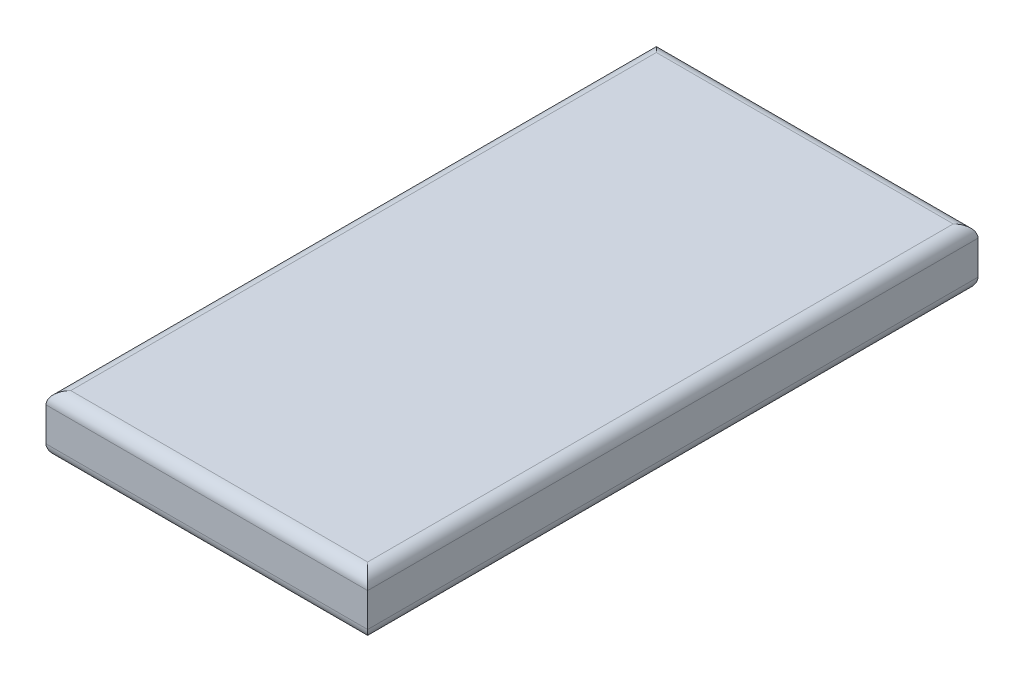
from build123d import *

# Parameters (mm, degrees)
SKETCH1_W           = 990.6
SKETCH1_H           = 1879.6
BOSS_EXTRUDE1_DEPTH = 180
FILLET1_R           = 38.1


with BuildPart() as part:
    # Sketch1 → Boss-Extrude1 (new body)
    with BuildSketch(Plane(origin=(0, 0, 0), x_dir=(1, 0, 0), z_dir=(0, 1, 0))):
        with Locations((495.3, 939.8)):
            Rectangle(SKETCH1_W, SKETCH1_H)
    extrude(amount=BOSS_EXTRUDE1_DEPTH)

    # Fillet1
    fillet1_edges = [part.edges().sort_by_distance(p)[0] for p in [
        (990.6, 180, -939.8),
        (495.3, 180, -1879.6),
        (0, 180, -939.8),
        (495.3, 0, -1879.6),
        (990.6, 0, -939.8),
        (495.3, 0, 0),
        (0, 0, -939.8),
        (495.3, 180, 0),
    ]]
    fillet(fillet1_edges, radius=FILLET1_R)


solid = part.part
